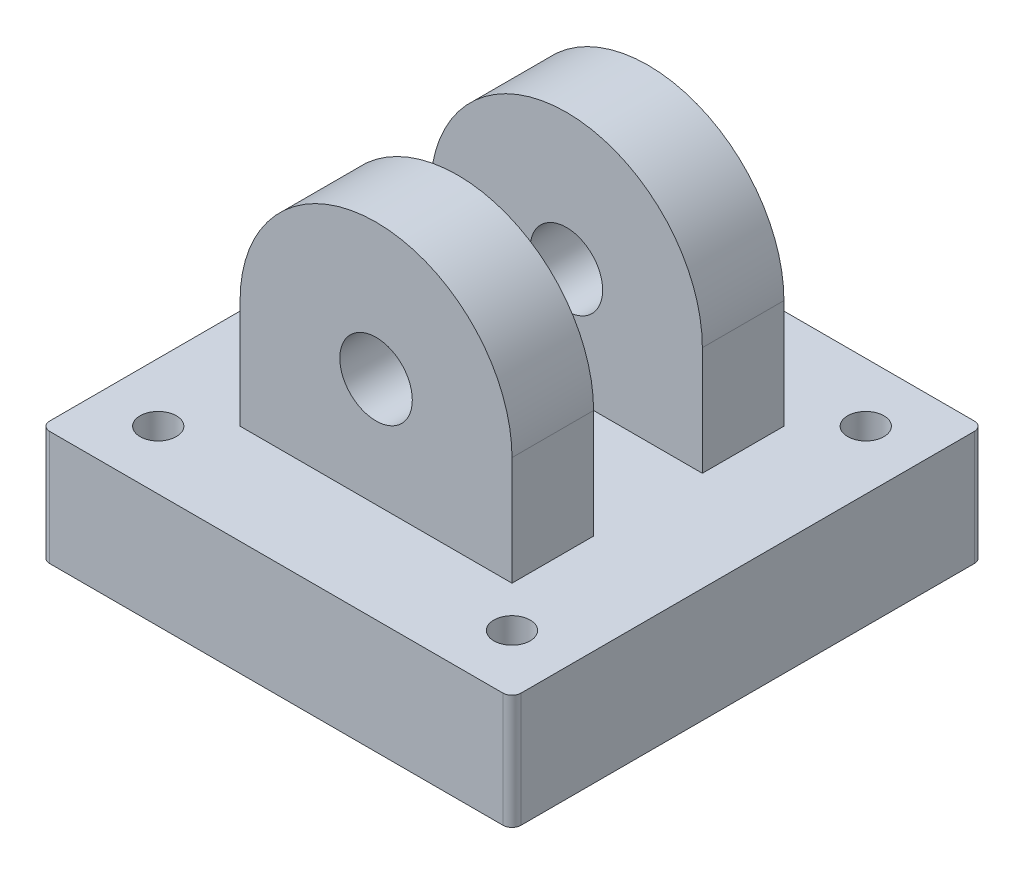
from build123d import *

# Parameters (mm, degrees)
BOSS_EXTRUDE1_DEPTH                    = 38.1
BOSS_EXTRUDE1_DEPTH_BACK               = 2
SKETCH1_W                              = 165.1
SKETCH1_H                              = 165.1
SKETCH3_W                              = 95.25
SKETCH3_H                              = 95.25
BOSS_EXTRUDE2_DEPTH                    = 38.1
BOSS_EXTRUDE3_DEPTH                    = 95.25
SKETCH5_R                              = 12.7
CUT_EXTRUDE1_DEPTH                     = 198.718647957
SKETCH6_W                              = 38.1
SKETCH6_H                              = 85.725
CUT_EXTRUDE2_DEPTH                     = 198.718647957
FILLET1_R                              = 3.175
SKETCH7_R                              = 26
CUT_EXTRUDE3_DEPTH                     = 36.83
SKETCH8_R                              = 76.2
SKETCH8_R_2                            = 69.85
CUT_EXTRUDE4_DEPTH                     = 8
F_1_2_14_NPSM_TAPPED_HOLE2_D           = 18.9738
F_1_2_14_NPSM_TAPPED_HOLE2_DEPTH       = 63.5
F_1_2_14_NPSM_TAPPED_HOLE2_CSINK_D     = 22.1742
F_1_2_14_NPSM_TAPPED_HOLE2_CSINK_ANGLE = 90
F_1_2_14_NPSM_TAPPED_HOLE2_TIP         = 5.700304607
SKETCH16_R                             = 6.35
CUT_EXTRUDE5_DEPTH                     = 25
SKETCH17_R                             = 6.35
CUT_EXTRUDE6_DEPTH                     = 172.641881908


with BuildPart() as part:
    # Sketch1 → Boss-Extrude1 (new, two sides: drawn at the far end of the back side and taken through both)
    with BuildSketch(Plane(origin=(0, 0, 0), x_dir=(1, 0, 0), z_dir=(0, 1, 0)).offset(-BOSS_EXTRUDE1_DEPTH_BACK)):
        Rectangle(SKETCH1_W, SKETCH1_H)
    extrude(amount=BOSS_EXTRUDE1_DEPTH + BOSS_EXTRUDE1_DEPTH_BACK)

    # Sketch3 → Boss-Extrude2 (add)
    with BuildSketch(Plane(origin=(0, 38.1, 0), x_dir=(1, 0, 0), z_dir=(0, 1, 0))):
        Rectangle(SKETCH3_W, SKETCH3_H)
    extrude(amount=BOSS_EXTRUDE2_DEPTH)

    # Sketch4 → Boss-Extrude3 (add)
    with BuildSketch(Plane.XY.offset(47.625)):
        with BuildLine():
            Line((-47.625, 76.2), (47.625, 76.2))
            ThreePointArc((47.625, 76.2), (0, 123.825), (-47.625, 76.2))
        make_face()
    extrude(amount=-BOSS_EXTRUDE3_DEPTH)

    # Sketch5 → Cut-Extrude1 (cut, through all)
    with BuildSketch(Plane.XY.offset(47.625)):
        with Locations((0, 76.2)):
            Circle(SKETCH5_R)
    extrude(amount=-CUT_EXTRUDE1_DEPTH, mode=Mode.SUBTRACT)

    # Sketch6 → Cut-Extrude2 (cut, through all)
    with BuildSketch(Plane.ZY.offset(47.625)):
        with Locations((0, 80.9625)):
            Rectangle(SKETCH6_W, SKETCH6_H)
    extrude(amount=-CUT_EXTRUDE2_DEPTH, mode=Mode.SUBTRACT)

    # Fillet1
    fillet1_edges = [part.edges().sort_by_distance(p)[0] for p in [
        (-82.55, 18.05, -82.55),
        (82.55, 18.05, -82.55),
        (82.55, 18.05, 82.55),
        (-82.55, 18.05, 82.55),
    ]]
    fillet(fillet1_edges, radius=FILLET1_R)

    # Sketch7 → Cut-Extrude3 (cut)
    with BuildSketch(Plane.XZ.offset(2)):
        with Locations(Location((0, 0, 0), (0, 0, 270))):
            Circle(SKETCH7_R)
    extrude(amount=-CUT_EXTRUDE3_DEPTH, mode=Mode.SUBTRACT)

    # Sketch8 → Cut-Extrude4 (cut)
    with BuildSketch(Plane.XZ.offset(2)):
        with Locations(Location((0, 0, 0), (0, 0, 270))):
            Circle(SKETCH8_R)
        with Locations(Location((0, 0, 0), (0, 0, 270))):
            Circle(SKETCH8_R_2, mode=Mode.SUBTRACT)
    extrude(amount=-CUT_EXTRUDE4_DEPTH, mode=Mode.SUBTRACT)

    # 1/2-14 NPSM Tapped Hole2
    with Locations(Plane.ZY.offset(82.55)):
        with Locations((0, 18.05)):
            CounterSinkHole(F_1_2_14_NPSM_TAPPED_HOLE2_D / 2, F_1_2_14_NPSM_TAPPED_HOLE2_CSINK_D / 2, depth=F_1_2_14_NPSM_TAPPED_HOLE2_DEPTH, counter_sink_angle=F_1_2_14_NPSM_TAPPED_HOLE2_CSINK_ANGLE)
            with Locations((0, 0, -(F_1_2_14_NPSM_TAPPED_HOLE2_DEPTH + F_1_2_14_NPSM_TAPPED_HOLE2_TIP / 2))):  # 118° drill point
                Cone(0, F_1_2_14_NPSM_TAPPED_HOLE2_D / 2, F_1_2_14_NPSM_TAPPED_HOLE2_TIP, mode=Mode.SUBTRACT)

    # Sketch16 → Cut-Extrude5 (cut)
    with BuildSketch(Plane.XZ.offset(2)):
        with Locations(Location((-50.55, 0, 0), (0, 0, 270))):
            Circle(SKETCH16_R)
    extrude(amount=-CUT_EXTRUDE5_DEPTH, mode=Mode.SUBTRACT)

    # Sketch17 → Cut-Extrude6 (cut, through all)
    with BuildSketch(Plane.XZ.offset(2)):
        with Locations(Location((-61.963767235, 61.963767235, 0), (0, 0, 270))):
            Circle(SKETCH17_R)
        with Locations(Location((61.963767235, 61.963767235, 0), (0, 0, 270))):
            Circle(SKETCH17_R)
        with Locations(Location((61.963767235, -61.963767235, 0), (0, 0, 270))):
            Circle(SKETCH17_R)
        with Locations(Location((-61.963767235, -61.963767235, 0), (0, 0, 270))):
            Circle(SKETCH17_R)
    extrude(amount=-CUT_EXTRUDE6_DEPTH, mode=Mode.SUBTRACT)


solid = part.part
